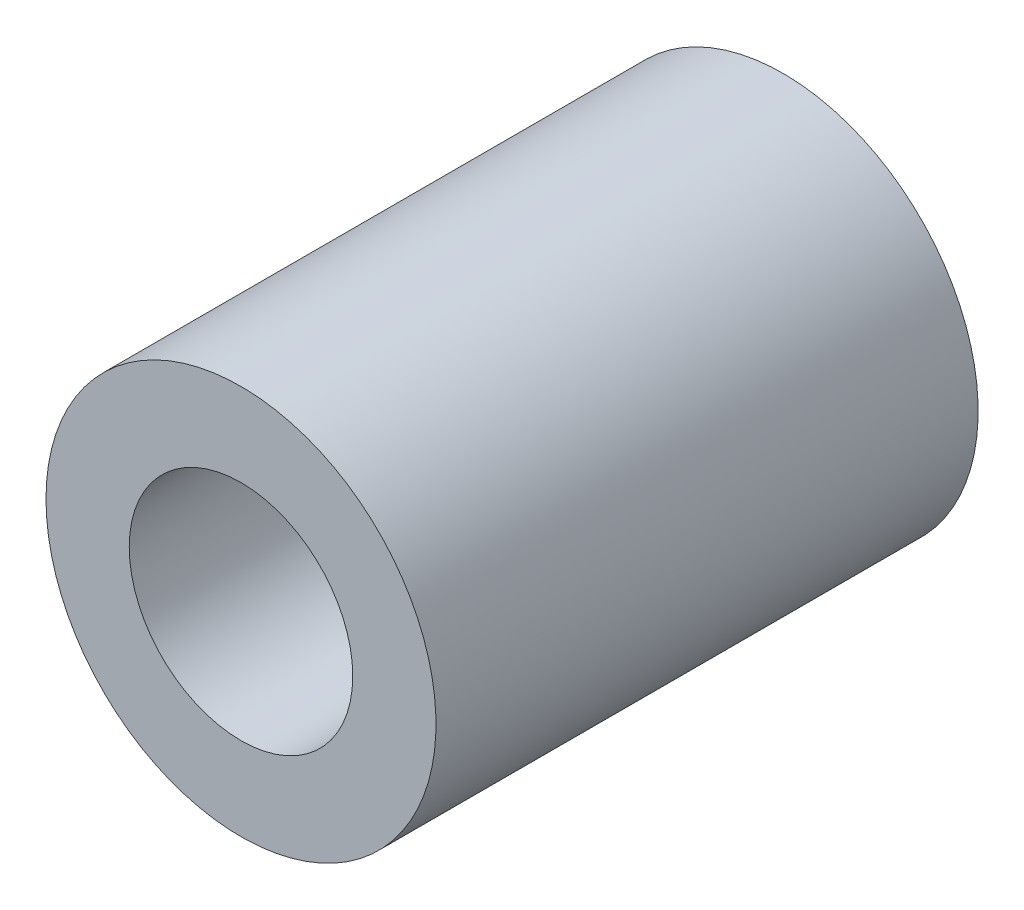
from build123d import *

# Parameters (mm, degrees)
SKETCH4_R           = 41
SKETCH4_R_2         = 23.5
BOSS_EXTRUDE2_DEPTH = 114


with BuildPart() as part:
    # Sketch4 → Boss-Extrude2 (new body)
    with BuildSketch(Plane.XY):
        with Locations(Location((0, 0, 0), (0, 0, 180))):
            Circle(SKETCH4_R)
        with Locations(Location((0, 0, 0), (0, 0, 180))):
            Circle(SKETCH4_R_2, mode=Mode.SUBTRACT)
    extrude(amount=BOSS_EXTRUDE2_DEPTH)


solid = part.part
